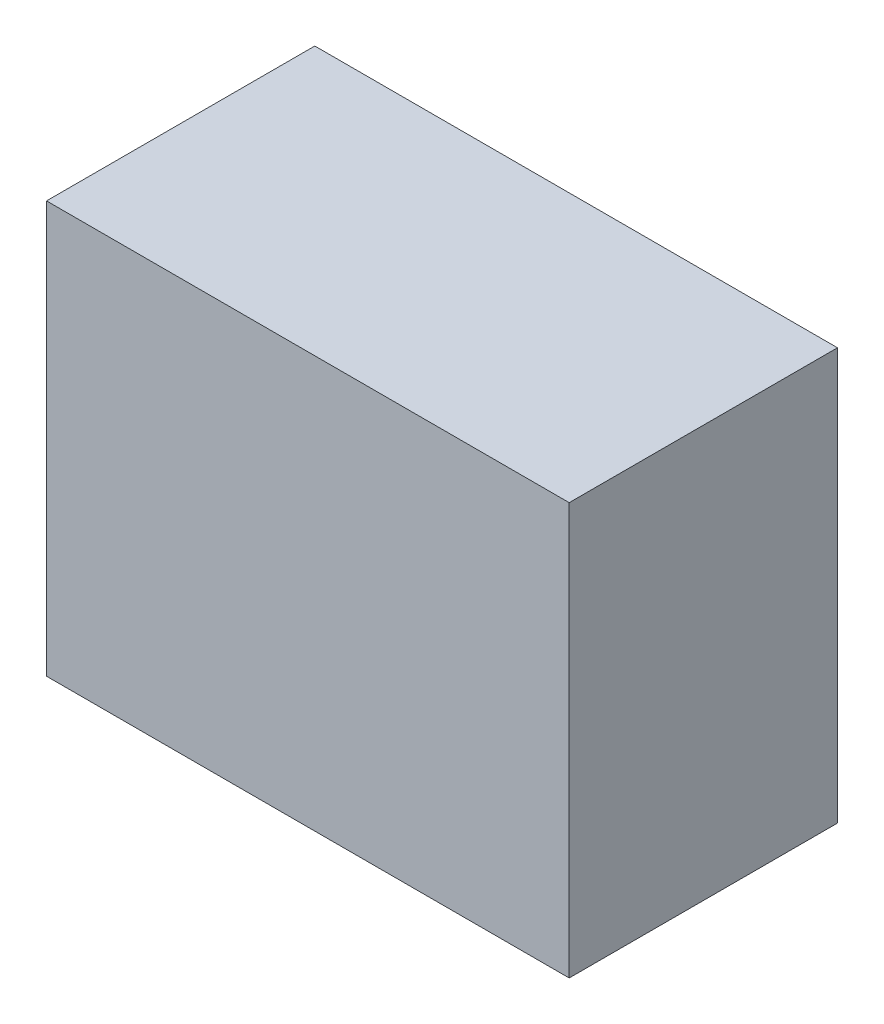
from build123d import *

# Parameters (mm, degrees)
SKETCH1_W           = 113
SKETCH1_H           = 58
BOSS_EXTRUDE1_DEPTH = 89


with BuildPart() as part:
    # Sketch1 → Boss-Extrude1 (new body)
    with BuildSketch(Plane(origin=(0, 0, 0), x_dir=(1, 0, 0), z_dir=(0, 1, 0))):
        Rectangle(SKETCH1_W, SKETCH1_H)
    extrude(amount=BOSS_EXTRUDE1_DEPTH)


solid = part.part
